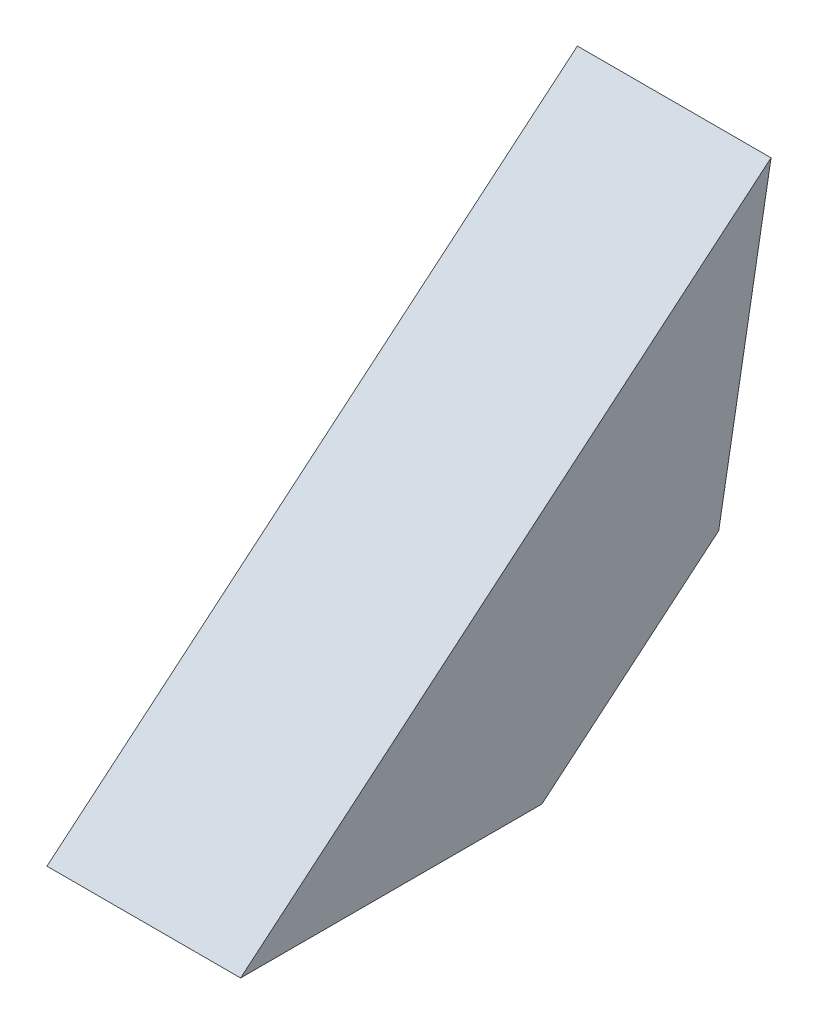
from build123d import *

# Parameters (mm, degrees)
BOSS_EXTRUDE1_DEPTH = 10


with BuildPart() as part:
    # Sketch1 → Boss-Extrude1 (new body)
    with BuildSketch(Plane(origin=(0, 0, 0), x_dir=(0, 0, -1), z_dir=(1, 0, 0))):
        Polygon((-15.557238269, 0), (0, 0), (9.129362172, 7.660444431), (11.830848247, 22.981333294), align=None)
    extrude(amount=BOSS_EXTRUDE1_DEPTH)


solid = part.part
